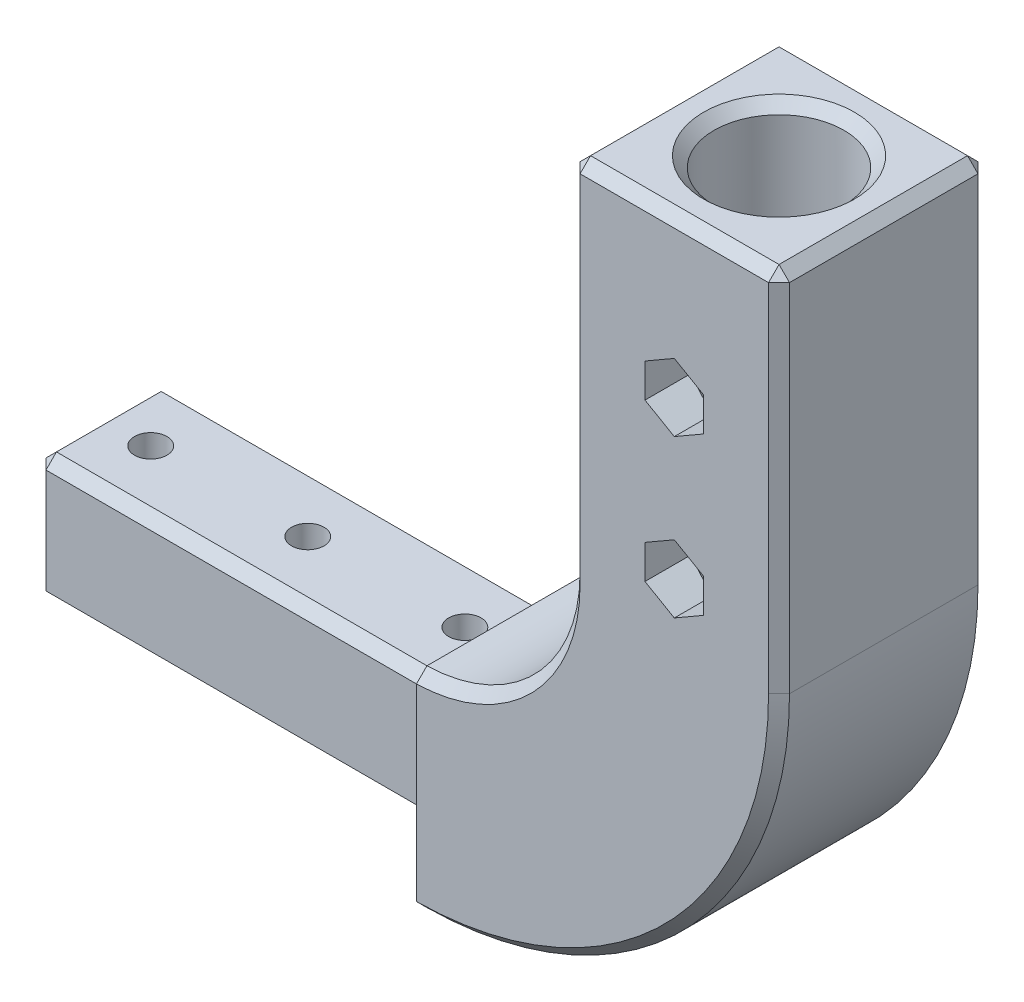
from build123d import *

# Parameters (mm, degrees)
SKETCH_13_R          = 1.55
EXTRUDE_6_DEPTH      = 20
SKETCH_15_R          = 6.2
CUT_EXTRUDE_4_DEPTH  = 40.1
SKETCH_16_R          = 1.55
CUT_EXTRUDE_5_DEPTH  = 93.330926639
CUT_EXTRUDE_7_DEPTH  = 105.522724888
EXTRUDE_8_DEPTH      = 20
CUT_EXTRUDE_8_DEPTH  = 4
CUT_EXTRUDE_9_DEPTH  = 5
SKETCH_29_W          = 20
SKETCH_29_H          = 20
SKETCH_29_W_2        = 12
SKETCH_29_H_2        = 12
CUT_EXTRUDE_11_DEPTH = 40.376839
CHAMFER_7_SIZE       = 1


with BuildPart() as part:
    # 草图13 → 凸台-拉伸6 (new body)
    with BuildSketch(Plane.XY):
        Polygon((0, 0), (45, 0), (75, 0), (75, 70), (55, 70), (55, 20), (45, 20), (0, 20), align=None)
        with Locations((65, 40)):
            Circle(SKETCH_13_R, mode=Mode.SUBTRACT)
        with Locations((65, 55)):
            Circle(SKETCH_13_R, mode=Mode.SUBTRACT)
    extrude(amount=EXTRUDE_6_DEPTH)

    # 草图15 → 切除-拉伸4 (cut)
    with BuildSketch(Plane(origin=(0, 70, 0), x_dir=(1, 0, 0), z_dir=(0, 1, 0))):
        with Locations(Location((65, -10, 0), (0, 0, 270))):
            Circle(SKETCH_15_R)
    extrude(amount=-CUT_EXTRUDE_4_DEPTH, mode=Mode.SUBTRACT)

    # 草图16 → 切除-拉伸5 (cut, through all)
    with BuildSketch(Plane(origin=(0, 20, 0), x_dir=(1, 0, 0), z_dir=(0, 1, 0))):
        with Locations(Location((5, -10, 0), (0, 0, 270))):
            Circle(SKETCH_16_R)
        with Locations(Location((20, -10, 0), (0, 0, 270))):
            Circle(SKETCH_16_R)
        with Locations(Location((35, -10, 0), (0, 0, 270))):
            Circle(SKETCH_16_R)
    extrude(amount=-CUT_EXTRUDE_5_DEPTH, mode=Mode.SUBTRACT)

    # 草图24 → 切除-拉伸7 (cut, through all)
    with BuildSketch(Plane(origin=(0, 0, 0), x_dir=(-1, 0, 0), z_dir=(0, 0, -1))):
        with BuildLine():
            Line((-75, 35), (-75, 0))
            Line((-75, 0), (-40, 0))
            ThreePointArc((-40, 0), (-64.748737342, 10.251262658), (-75, 35))
        make_face()
    extrude(amount=-CUT_EXTRUDE_7_DEPTH, mode=Mode.SUBTRACT)

    # 草图25 → 凸台-拉伸8 (add)
    with BuildSketch(Plane(origin=(0, 0, 0), x_dir=(-1, 0, 0), z_dir=(0, 0, -1))):
        with BuildLine():
            Line((-55, 34.995265669), (-55, 20))
            Line((-55, 20), (-40.376838854, 20))
            ThreePointArc((-40.376838854, 20), (-50.739007934, 24.522744072), (-55, 34.995265669))
        make_face()
    extrude(amount=-EXTRUDE_8_DEPTH)

    # 草图26 → 切除-拉伸8 (cut)
    with BuildSketch(Plane.XZ):
        Polygon((4.044652328, 6.911206682), (7.197299644, 7.628247988), (8.152647316, 10.717041306), (5.955347672, 13.088793318), (2.802700356, 12.371752012), (1.847352684, 9.282958694), align=None)
        Polygon((19.044652328, 6.911206682), (22.197299644, 7.628247988), (23.152647316, 10.717041306), (20.955347672, 13.088793318), (17.802700356, 12.371752012), (16.847352684, 9.282958694), align=None)
        Polygon((34.044652328, 6.911206682), (37.197299644, 7.628247988), (38.152647316, 10.717041306), (35.955347672, 13.088793318), (32.802700356, 12.371752012), (31.847352684, 9.282958694), align=None)
    extrude(amount=-CUT_EXTRUDE_8_DEPTH, mode=Mode.SUBTRACT)

    # 草图27 → 切除-拉伸9 (cut)
    with BuildSketch(Plane(origin=(0, 0, 20), x_dir=(-1, 0, 0), z_dir=(0, 0, -1))):
        Polygon((-65, 36.766838493), (-62.2, 38.383419246), (-62.2, 41.616580754), (-65, 43.233161507), (-67.8, 41.616580754), (-67.8, 38.383419246), align=None)
        Polygon((-65, 51.766838493), (-62.2, 53.383419246), (-62.2, 56.616580754), (-65, 58.233161507), (-67.8, 56.616580754), (-67.8, 53.383419246), align=None)
    extrude(amount=CUT_EXTRUDE_9_DEPTH, mode=Mode.SUBTRACT)

    # 草图29 → 切除-拉伸11 (cut)
    with BuildSketch(Plane.ZY):
        with Locations((10, 10)):
            Rectangle(SKETCH_29_W, SKETCH_29_H)
        with Locations((10, 10)):
            Rectangle(SKETCH_29_W_2, SKETCH_29_H_2, mode=Mode.SUBTRACT)
    extrude(amount=-CUT_EXTRUDE_11_DEPTH, mode=Mode.SUBTRACT)

    # 倒角7
    chamfer_7_edges = [part.edges().sort_by_distance(p)[0] for p in [
        (55, 70, 10),
        (75, 70, 10),
        (65, 70, 20),
        (64.881613342, 10.384855932, 0),
        (64.881613342, 10.384855932, 20),
        (0, 16, 10),
        (20.1884195, 16, 16),
        (0, 4, 10),
        (20.1884195, 4, 4),
        (0, 10, 16),
        (20.1884195, 4, 16),
        (0, 10, 4),
        (20.1884195, 16, 4),
        (55, 52.497632834, 20),
        (65, 70, 3.8),
        (75, 52.5, 0),
        (75, 52.5, 20),
        (50.739007934, 24.522744072, 0),
        (50.739007934, 24.522744072, 20),
        (55, 52.497632834, 0),
        (65, 70, 0),
    ]]
    chamfer(chamfer_7_edges, length=CHAMFER_7_SIZE)


solid = part.part
